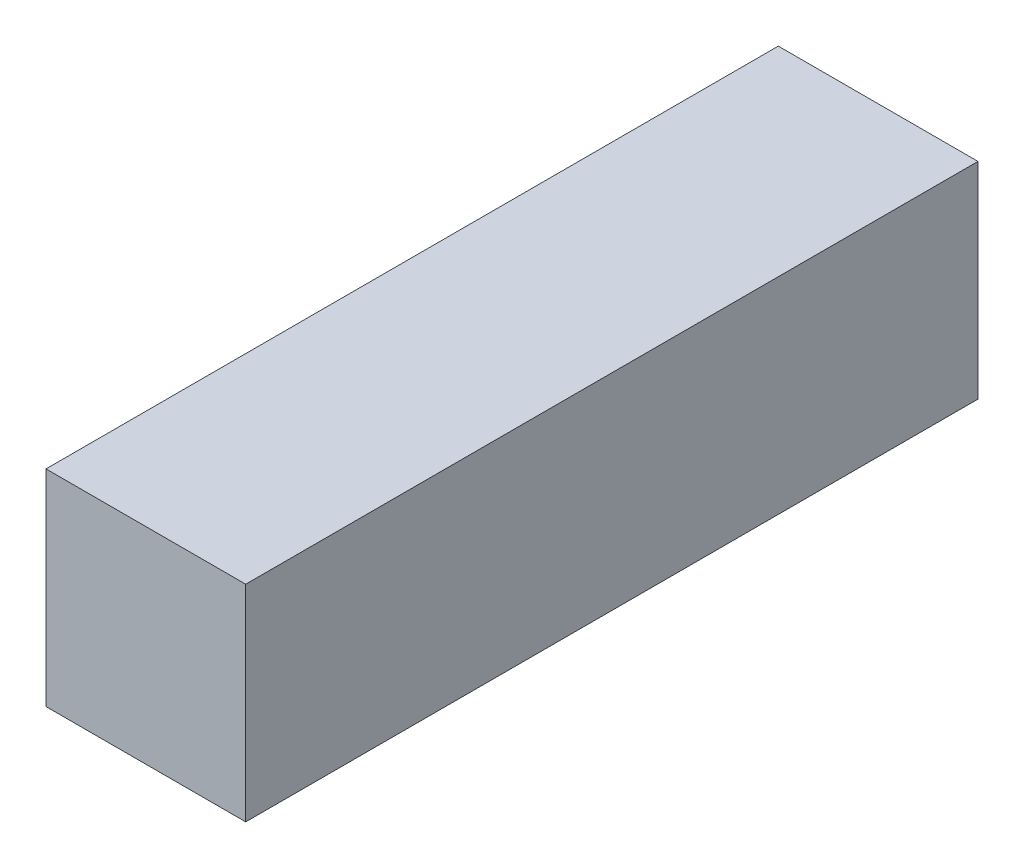
from build123d import *

# Parameters (mm, degrees)
SKETCH2_W           = 2.999994
SKETCH2_H           = 10.999978
BOSS_EXTRUDE1_DEPTH = 3.092196


with BuildPart() as part:
    # Sketch2 → Boss-Extrude1 (new body)
    with BuildSketch(Plane(origin=(0, 0, 0), x_dir=(1, 0, 0), z_dir=(0, 1, 0))):
        Rectangle(SKETCH2_W, SKETCH2_H)
    extrude(amount=BOSS_EXTRUDE1_DEPTH)


solid = part.part
